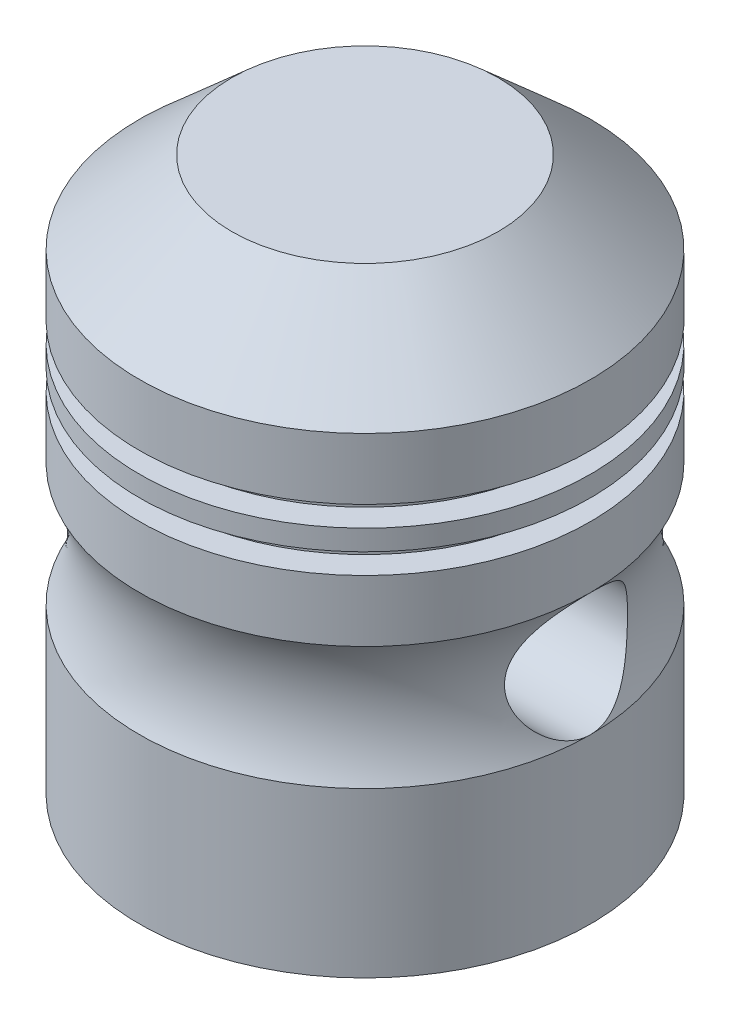
from build123d import *

# Parameters (mm, degrees)
CUT_EXTRUDE1_DEPTH      = 19
CUT_EXTRUDE2_DEPTH      = 32.160872902
CUT_EXTRUDE2_DEPTH_BACK = 32.160872902
SKETCH3_R               = 3


with BuildPart() as part:
    # Sketch1 → Revolve1 (revolve)
    with BuildSketch(Plane.XY, mode=Mode.PRIVATE) as revolve1_sk:
        with BuildLine():
            Line((0, 27), (-6.5, 27))
            Line((-6.5, 27), (-11, 23))
            Line((-11, 23), (-11, 20))
            Line((-11, 20), (-9.75, 20))
            Line((-9.75, 20), (-9.75, 19))
            Line((-9.75, 19), (-11, 19))
            Line((-11, 19), (-11, 18))
            Line((-11, 18), (-9.75, 18))
            Line((-9.75, 18), (-9.75, 17))
            Line((-9.75, 17), (-11, 17))
            Line((-11, 17), (-11, 14))
            ThreePointArc((-11, 14), (-10.250666035, 11), (-11, 8))
            Line((-11, 8), (-11, 0))
            Line((-11, 0), (-9.75, 0))
            Line((-9.75, 0), (-9.75, 6))
            Line((-9.75, 6), (0, 6))
            Line((0, 6), (0, 27))
        make_face()
    revolve(revolve1_sk.sketch.rotate(Axis((0, -30.957446809, 0), (0, 1, 0)), 270), axis=Axis((0, -30.957446809, 0), (0, 1, 0)))

    # Sketch2 → Cut-Extrude1 (cut)
    with BuildSketch(Plane(origin=(0, 0, 0), x_dir=(1, 0, 0), z_dir=(0, 1, 0))):
        with BuildLine():
            Line((-5, -3.5), (-5, 3.5))
            ThreePointArc((-5, 3.5), (0, 8.5), (5, 3.5))
            Line((5, 3.5), (5, -3.5))
            ThreePointArc((5, -3.5), (0, -8.5), (-5, -3.5))
        make_face()
    extrude(amount=CUT_EXTRUDE1_DEPTH, mode=Mode.SUBTRACT)

    # Sketch3 → Cut-Extrude2 (cut, two sides: drawn at the far end of the back side and taken through both)
    with BuildSketch(Plane(origin=(0, 0, 0), x_dir=(0, 0, -1), z_dir=(1, 0, 0)).offset(-CUT_EXTRUDE2_DEPTH_BACK)):
        with Locations((0, 11)):
            Circle(SKETCH3_R)
    extrude(amount=CUT_EXTRUDE2_DEPTH + CUT_EXTRUDE2_DEPTH_BACK, mode=Mode.SUBTRACT)


solid = part.part
